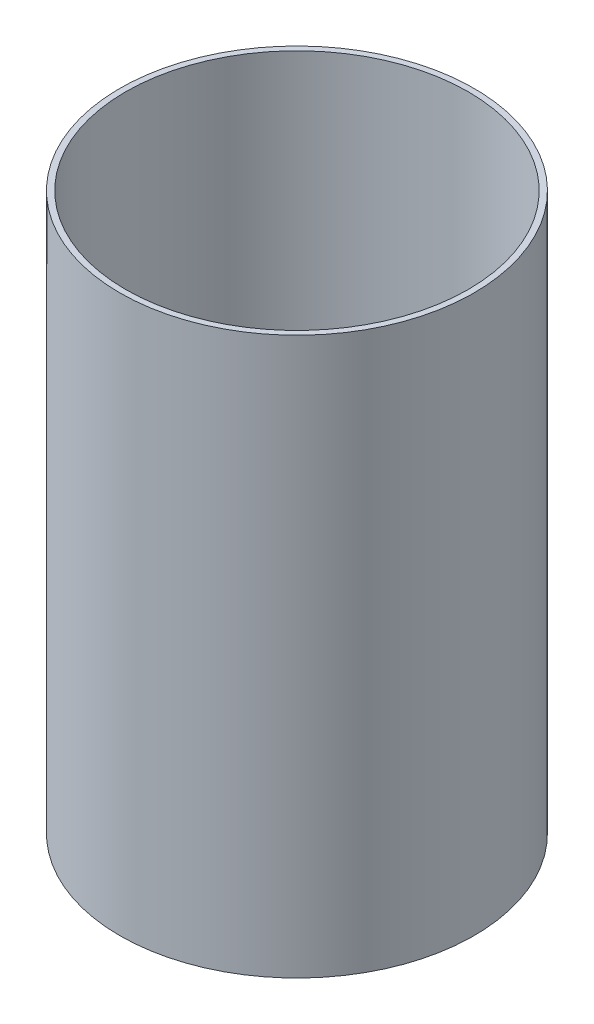
from build123d import *

# Parameters (mm, degrees)
SKETCH1_R           = 45.5
SKETCH1_R_2         = 44
BOSS_EXTRUDE1_DEPTH = 143


with BuildPart() as part:
    # Sketch1 → Boss-Extrude1 (new body)
    with BuildSketch(Plane(origin=(0, 0, 0), x_dir=(1, 0, 0), z_dir=(0, 1, 0))):
        with Locations(Location((0, 0, 0), (0, 0, 270))):
            Circle(SKETCH1_R)
        with Locations(Location((0, 0, 0), (0, 0, 270))):
            Circle(SKETCH1_R_2, mode=Mode.SUBTRACT)
    extrude(amount=BOSS_EXTRUDE1_DEPTH)


solid = part.part
